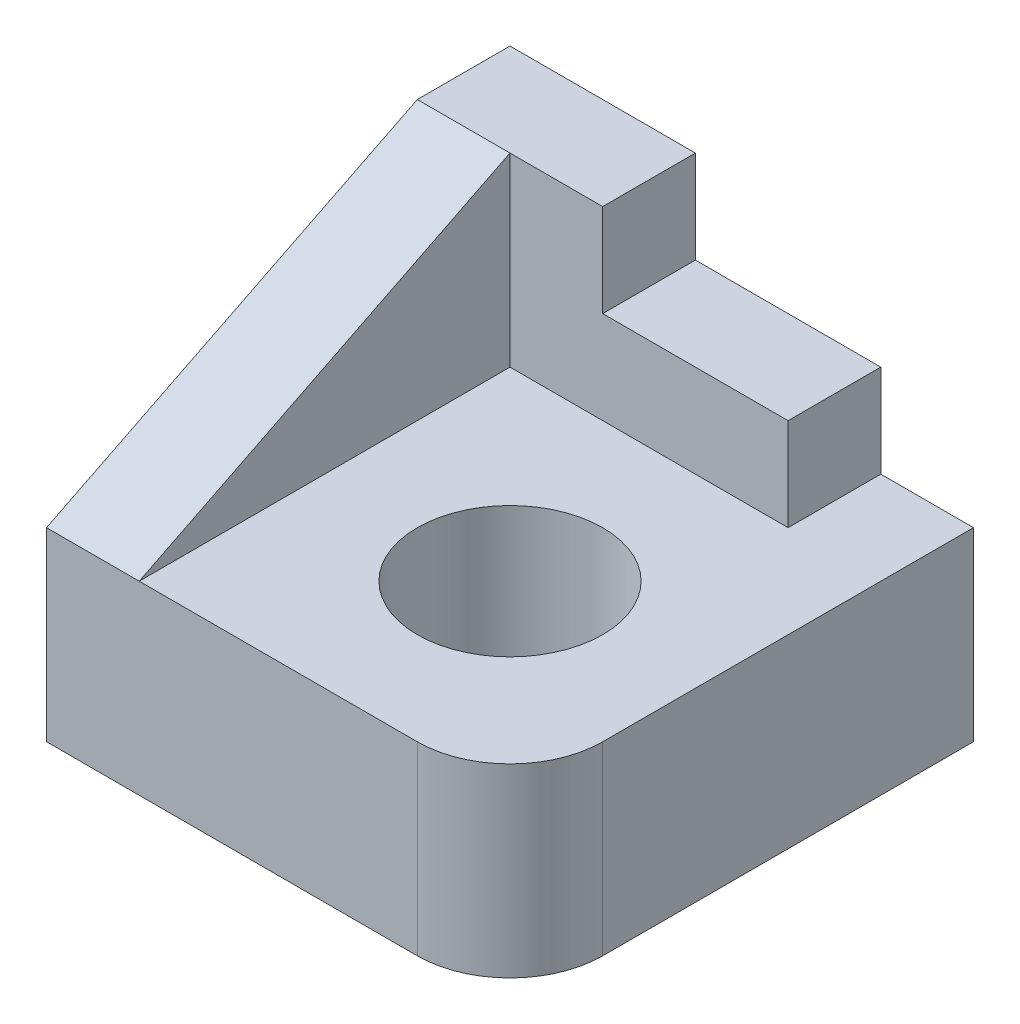
from build123d import *

# Parameters (mm, degrees)
SKETCH_1_R      = 5
EXTRUDE_1_DEPTH = 10
SKETCH_2_W      = 10
SKETCH_2_H      = 5
EXTRUDE_2_DEPTH = 5
EXTRUDE_3_DEPTH = 5


with BuildPart() as part:
    # 草圖1 → 填料-伸長1 (new body)
    with BuildSketch(Plane(origin=(0, 0, 0), x_dir=(1, 0, 0), z_dir=(0, 1, 0))):
        with BuildLine():
            Line((0, 0), (25, 0))
            Line((25, 0), (25, -20))
            ThreePointArc((25, -20), (23.535533906, -23.535533906), (20, -25))
            Line((20, -25), (0, -25))
            Line((0, -25), (0, 0))
        make_face()
        with Locations(Location((15, -15, 0), (0, 0, 270))):
            Circle(SKETCH_1_R, mode=Mode.SUBTRACT)
    extrude(amount=EXTRUDE_1_DEPTH)

    # 草圖2 → 填料-伸長2 (add)
    with BuildSketch(Plane(origin=(0, 0, 0), x_dir=(-1, 0, 0), z_dir=(0, 0, -1))):
        Polygon((-10, 10), (0, 10), (0, 20), (-10, 20), (-10, 15), align=None)
        with Locations((-15, 12.5)):
            Rectangle(SKETCH_2_W, SKETCH_2_H)
    extrude(amount=-EXTRUDE_2_DEPTH)

    # 草圖3 → 填料-伸長3 (add)
    with BuildSketch(Plane.ZY):
        Polygon((5, 20), (5, 10), (25, 10), align=None)
    extrude(amount=-EXTRUDE_3_DEPTH)


solid = part.part
